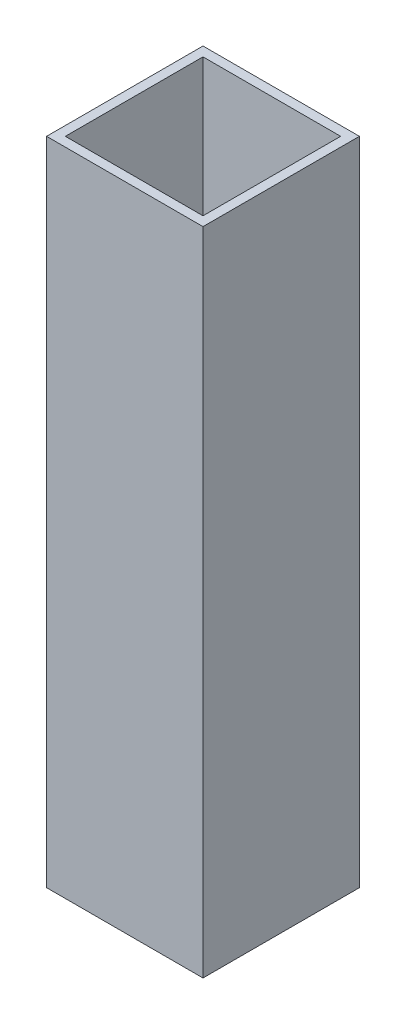
from build123d import *

# Parameters (mm, degrees)
SKETCH1_W           = 12.5
SKETCH1_H           = 12.5
SKETCH1_W_2         = 11
SKETCH1_H_2         = 11
BOSS_EXTRUDE3_DEPTH = 52


with BuildPart() as part:
    # Sketch1 → Boss-Extrude3 (new body)
    with BuildSketch(Plane(origin=(0, 0, 0), x_dir=(1, 0, 0), z_dir=(0, 1, 0))):
        with Locations((-20.377754415, -4.412827368)):
            Rectangle(SKETCH1_W, SKETCH1_H)
        with Locations((-20.377754415, -4.412827368)):
            Rectangle(SKETCH1_W_2, SKETCH1_H_2, mode=Mode.SUBTRACT)
    extrude(amount=BOSS_EXTRUDE3_DEPTH)


solid = part.part
